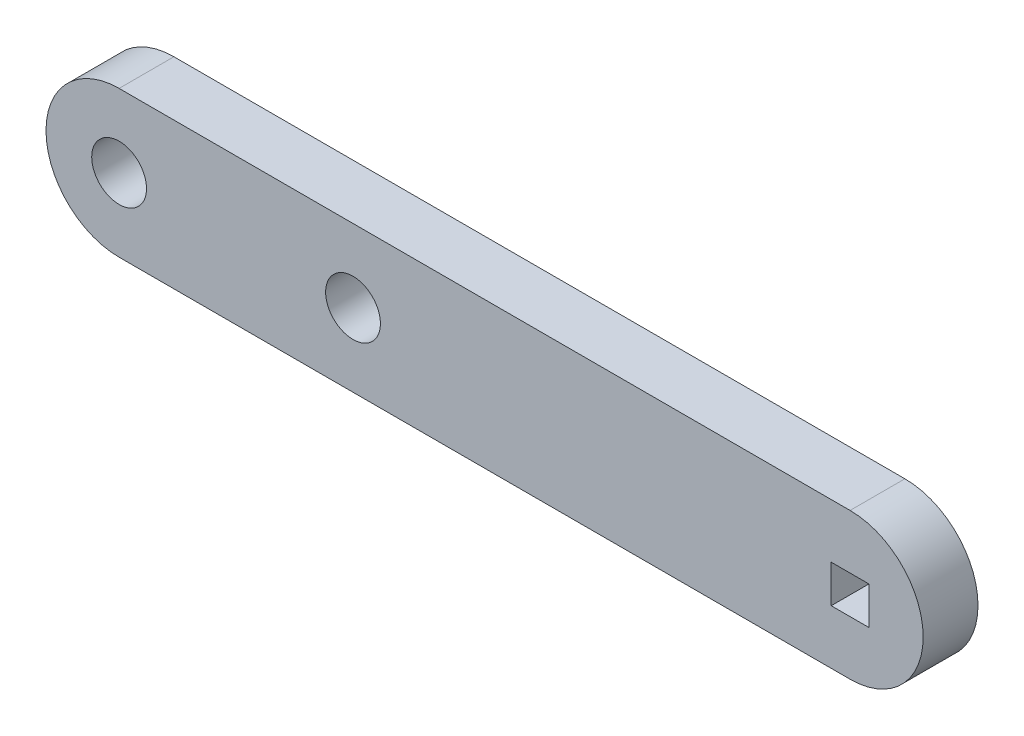
from build123d import *

# Parameters (mm, degrees)
SKETCH1_R           = 2.38125
SKETCH1_W           = 3.2766
SKETCH1_H           = 3.2766
BOSS_EXTRUDE1_DEPTH = 4.7625


with BuildPart() as part:
    # Sketch1 → Boss-Extrude1 (new body)
    with BuildSketch(Plane.XY):
        with BuildLine():
            Line((0, 6.35), (63.5, 6.35))
            ThreePointArc((63.5, 6.35), (69.85, 0), (63.5, -6.35))
            Line((63.5, -6.35), (0, -6.35))
            ThreePointArc((0, -6.35), (-6.35, 0), (0, 6.35))
        make_face()
        with Locations(Location((0, 0, 0), (0, 0, 180))):
            Circle(SKETCH1_R, mode=Mode.SUBTRACT)
        with Locations(Location((20.32, 0, 0), (0, 0, 180))):
            Circle(SKETCH1_R, mode=Mode.SUBTRACT)
        with Locations((63.5, 0)):
            Rectangle(SKETCH1_W, SKETCH1_H, mode=Mode.SUBTRACT)
    extrude(amount=BOSS_EXTRUDE1_DEPTH)


solid = part.part
